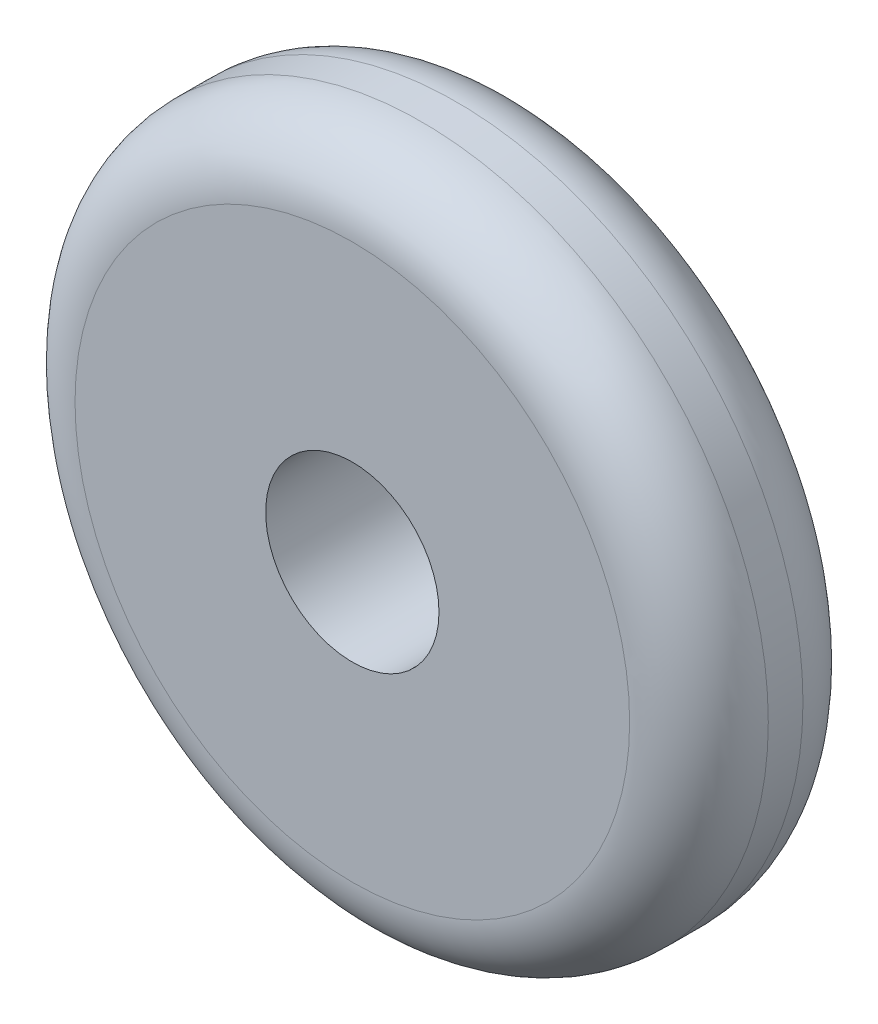
from build123d import *

# Parameters (mm, degrees)
SKETCH1_R           = 25.4
SKETCH1_R_2         = 6.35
BOSS_EXTRUDE1_DEPTH = 12.7
FILLET1_R           = 5.08


with BuildPart() as part:
    # Sketch1 → Boss-Extrude1 (new body)
    with BuildSketch(Plane.XY):
        Circle(SKETCH1_R)
        Circle(SKETCH1_R_2, mode=Mode.SUBTRACT)
    extrude(amount=BOSS_EXTRUDE1_DEPTH)

    # Fillet1
    fillet1_edges = [part.edges().sort_by_distance(p)[0] for p in [
        (-25.4, 0, 0),
        (-25.4, 0, 12.7),
    ]]
    fillet(fillet1_edges, radius=FILLET1_R)


solid = part.part
